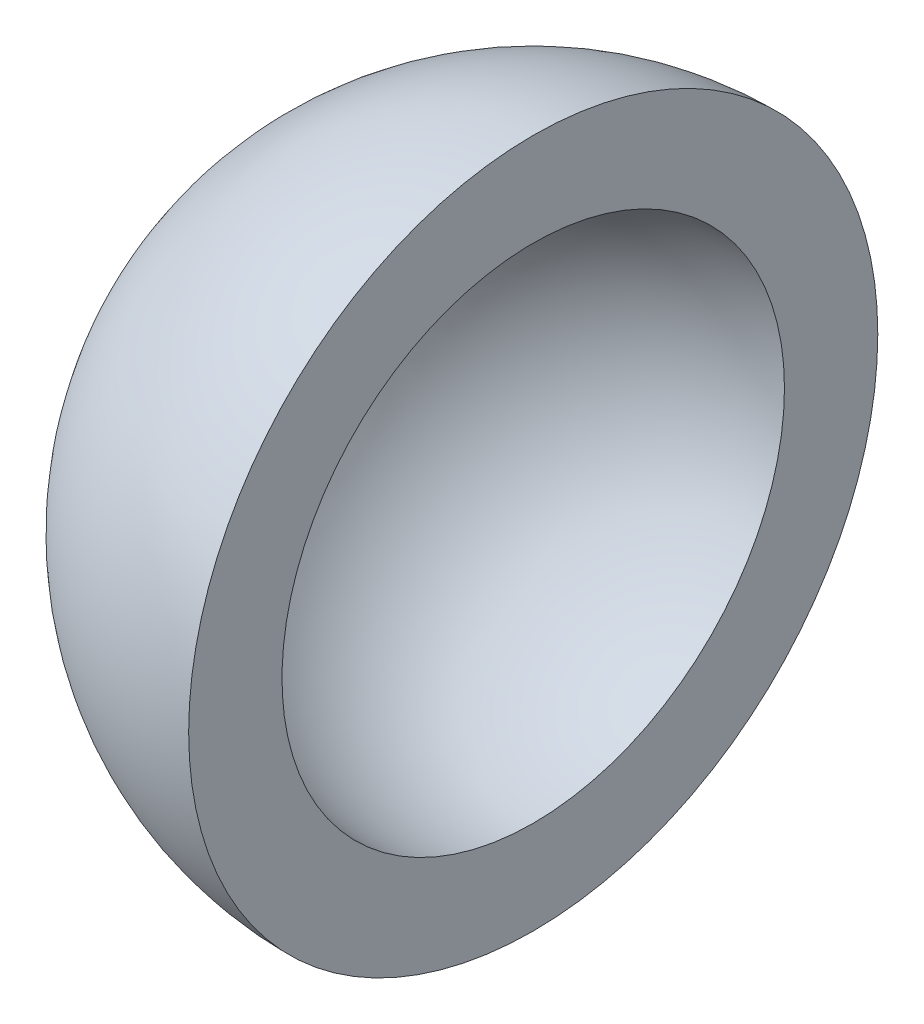
from build123d import *


with BuildPart() as part:
    # Sketch4 → Revolve3 (revolve)
    with BuildSketch(Plane.XY):
        with BuildLine():
            Line((-5.810439407, 0), (-4.236585252, 0))
            ThreePointArc((-4.236585252, 0), (-2.99571816, -2.99571816), (0, -4.236585252))
            Line((0, -4.236585252), (0, -5.810439407))
            ThreePointArc((0, -5.810439407), (-4.108601107, -4.108601107), (-5.810439407, 0))
        make_face()
    revolve(axis=Axis((0, 0, 0), (-1, 0, 0)))


solid = part.part
